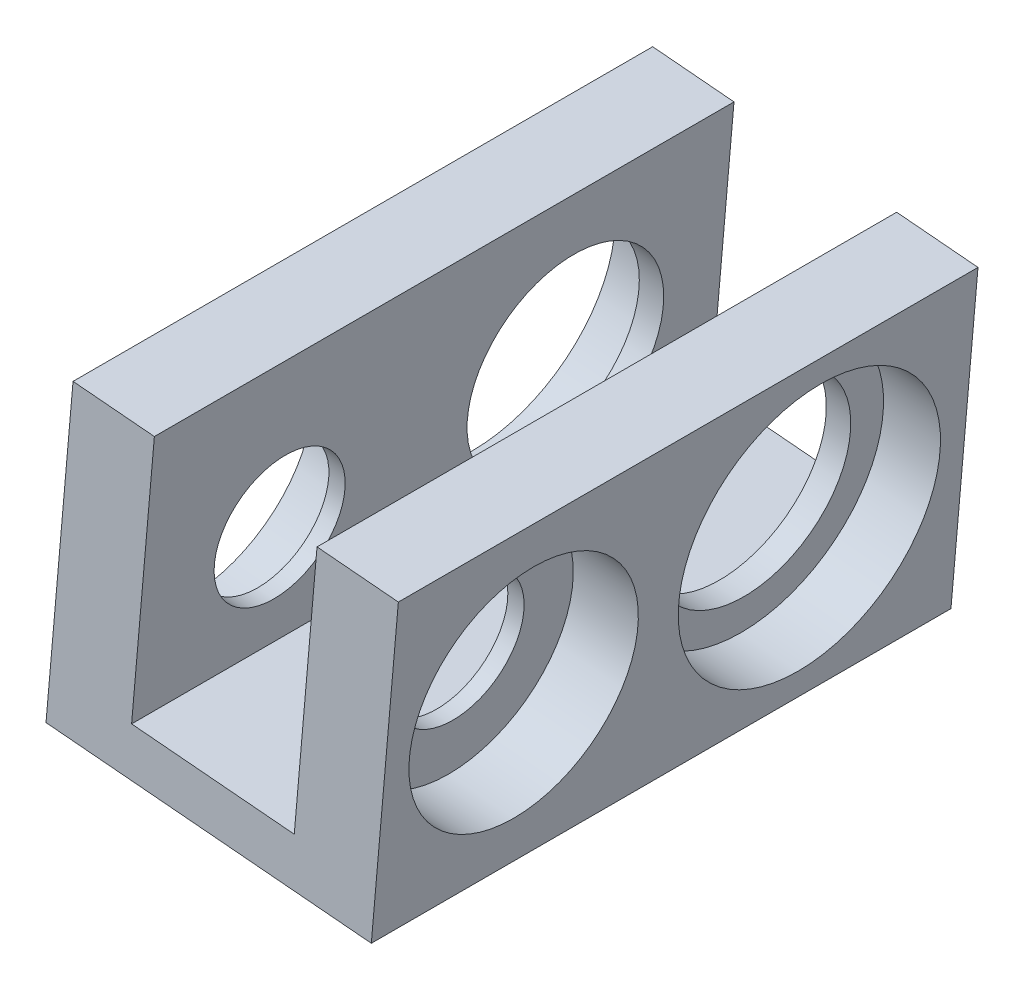
from build123d import *

# Parameters (mm, degrees)
SKETCH1_W           = 71
SKETCH1_H           = 38
SKETCH1_R           = 12
SKETCH1_R_2         = 8
BOSS_EXTRUDE1_DEPTH = 40
SKETCH7_R           = 16
CUT_EXTRUDE4_DEPTH  = 7
SKETCH8_R           = 14
CUT_EXTRUDE5_DEPTH  = 8
CUT_EXTRUDE6_START  = -7
SKETCH9_R           = 16
CUT_EXTRUDE6_DEPTH  = 7
CUT_EXTRUDE7_START  = -8
SKETCH10_R          = 14
CUT_EXTRUDE7_DEPTH  = 8
CUT_EXTRUDE8_DEPTH  = 92.306031742


with BuildPart() as part:
    # Sketch1 → Boss-Extrude1 (new body)
    with BuildSketch(Plane(origin=(0, 0, 0), x_dir=(0, 0, 1), z_dir=(-0.9961946980917459, 0.08715574274765504, 0))):
        with Locations((-1, 19)):
            Rectangle(SKETCH1_W, SKETCH1_H)
        with Locations((-17.5, 19)):
            Circle(SKETCH1_R, mode=Mode.SUBTRACT)
        with Locations((17.5, 19)):
            Circle(SKETCH1_R_2, mode=Mode.SUBTRACT)
    extrude(amount=-BOSS_EXTRUDE1_DEPTH)

    # Sketch7 → Cut-Extrude4 (cut)
    with BuildSketch(Plane(origin=(0, 0, 0), x_dir=(0, 0, 1), z_dir=(-0.9961946980917459, 0.08715574274765503, 0))):
        with Locations((-17.5, 19)):
            Circle(SKETCH7_R)
    extrude(amount=-CUT_EXTRUDE4_DEPTH, mode=Mode.SUBTRACT)

    # Sketch8 → Cut-Extrude5 (cut)
    with BuildSketch(Plane(origin=(0, 0, 0), x_dir=(0, 0, 1), z_dir=(-0.9961946980917459, 0.08715574274765503, 0))):
        with Locations((17.5, 19)):
            Circle(SKETCH8_R)
    extrude(amount=-CUT_EXTRUDE5_DEPTH, mode=Mode.SUBTRACT)

    # Sketch9 → Cut-Extrude6 (cut)
    with BuildSketch(Plane(origin=(39.847787924, -3.48622971, 0), x_dir=(0, 0, -1), z_dir=(0.9961946980917459, -0.08715574274765503, 0)).offset(CUT_EXTRUDE6_START)):
        with Locations((17.5, 19)):
            Circle(SKETCH9_R)
    extrude(amount=CUT_EXTRUDE6_DEPTH, mode=Mode.SUBTRACT)

    # Sketch10 → Cut-Extrude7 (cut)
    with BuildSketch(Plane(origin=(39.847787924, -3.48622971, 0), x_dir=(0, 0, -1), z_dir=(0.9961946980917459, -0.08715574274765503, 0)).offset(CUT_EXTRUDE7_START)):
        with Locations((-17.5, 19)):
            Circle(SKETCH10_R)
    extrude(amount=CUT_EXTRUDE7_DEPTH, mode=Mode.SUBTRACT)

    # Sketch11 → Cut-Extrude8 (cut, through all)
    with BuildSketch(Plane.XY.offset(34.5)):
        Polygon((13.273865205, 36.9838411), (33.197759167, 35.240726245), (30.408775399, 3.362495906), (10.484881437, 5.105610761), align=None)
    extrude(amount=-CUT_EXTRUDE8_DEPTH, mode=Mode.SUBTRACT)


solid = part.part
